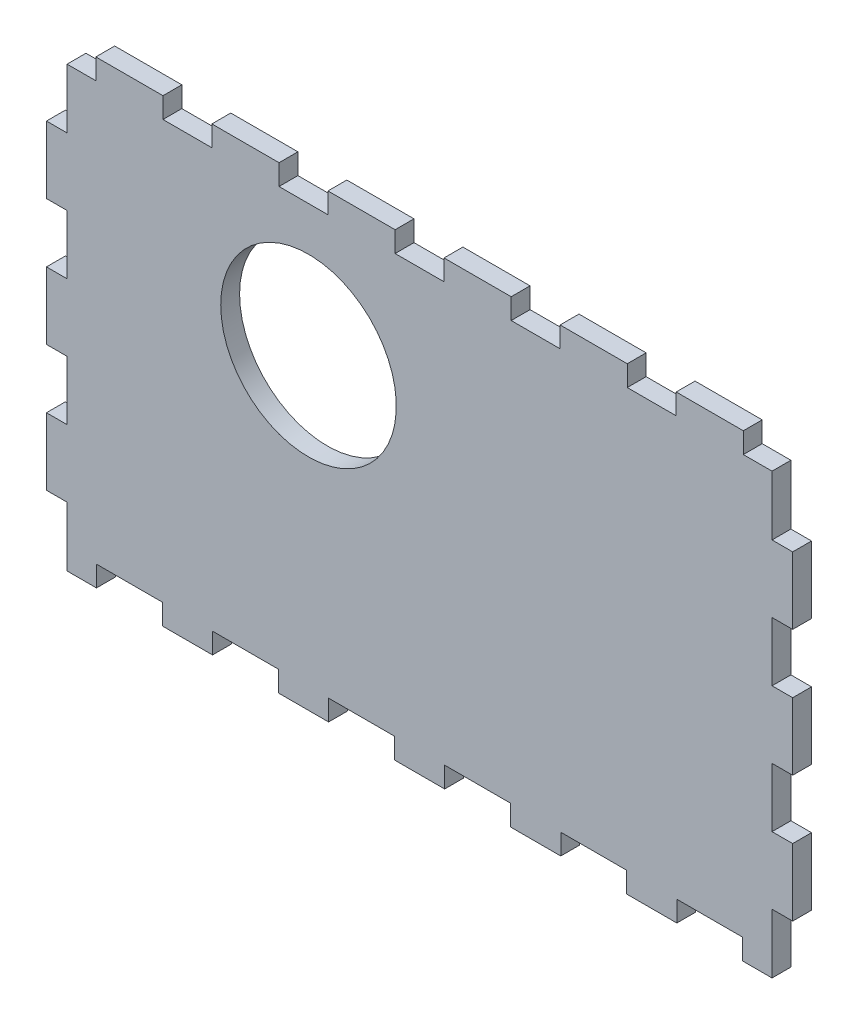
from build123d import *

# Parameters (mm, degrees)
SKETCH2_R           = 20
BOSS_EXTRUDE1_DEPTH = 4.3


with BuildPart() as part:
    # Sketch2 → Boss-Extrude1 (new body)
    with BuildSketch(Plane.XY):
        Polygon((0, 0), (6.693, 0), (6.693, 4.7), (21.693, 4.7), (21.693, 0), (33.136, 0), (33.136, 4.7), (48.136, 4.7), (48.136, 0), (59.579, 0), (59.579, 4.7), (74.579, 4.7), (74.579, 0), (86.022, 0), (86.022, 4.7), (101.022, 4.7), (101.022, 0), (112.465, 0), (112.465, 4.7), (127.465, 4.7), (127.465, 0), (138.908, 0), (138.908, 4.7), (153.908, 4.7), (153.908, 0), (160.6, 0), (160.6, 13.575), (165.3, 13.575), (165.3, 28.875), (160.6, 28.875), (160.6, 42.35), (165.3, 42.35), (165.3, 57.65), (160.6, 57.65), (160.6, 71.125), (165.3, 71.125), (165.3, 86.425), (160.6, 86.425), (160.6, 100), (154.058, 100), (154.058, 104.7), (138.758, 104.7), (138.758, 100), (127.615, 100), (127.615, 104.7), (112.315, 104.7), (112.315, 100), (101.172, 100), (101.172, 104.7), (85.872, 104.7), (85.872, 100), (74.729, 100), (74.729, 104.7), (59.429, 104.7), (59.429, 100), (48.286, 100), (48.286, 104.7), (32.986, 104.7), (32.986, 100), (21.843, 100), (21.843, 104.7), (6.543, 104.7), (6.543, 100), (0, 100), (0, 86.425), (-4.7, 86.425), (-4.7, 71.125), (0, 71.125), (0, 57.65), (-4.7, 57.65), (-4.7, 42.35), (0, 42.35), (0, 28.875), (-4.7, 28.875), (-4.7, 13.575), (0, 13.575), align=None)
        with Locations(Location((55, 70, 0), (0, 0, 180))):
            Circle(SKETCH2_R, mode=Mode.SUBTRACT)
    extrude(amount=BOSS_EXTRUDE1_DEPTH)


solid = part.part
